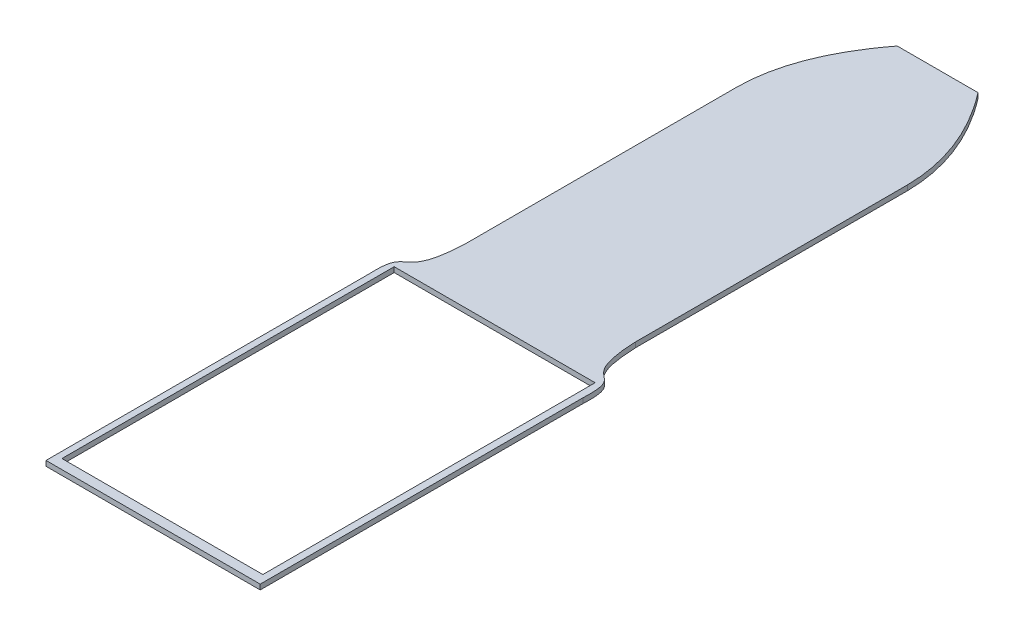
from build123d import *

# Parameters (mm, degrees)
BOSS_EXTRUDE1_DEPTH = 1.5
SKETCH17_W          = 59.095547363
SKETCH17_H          = 97.719033267
CUT_EXTRUDE2_DEPTH  = 165.658179571


with BuildPart() as part:
    # Sketch1 → Boss-Extrude1 (new body)
    with BuildSketch(Plane(origin=(0, 0, 0), x_dir=(-1, 0, 0), z_dir=(0, -1, 0))):
        with BuildLine():
            Line((-68.228994051, -80.900990016), (-68.228994051, 14.099009984))
            add(Edge.make_bspline(
                [(-61.728994051, 35.999084059), (-62.421478219, 17.933639863), (-67.544211434, 25.081077147), (-68.540266051, 21.159243181), (-68.228994051, 14.099009984)],
                knots=[0, 0, 0, 0, 0, 1, 1, 1, 1, 1], degree=4))
            Line((-61.728994051, 35.999084059), (-61.728994051, 115.999084059))
            add(Edge.make_bspline(
                [(-61.728994051, 115.999084059), (-61.589708219, 128.711907965), (-56.064830782, 140.140701438), (-48.600220127, 149.828937742)],
                knots=[0, 0, 0, 0, 1, 1, 1, 1], degree=3))
            Line((-48.600220127, 149.828937742), (-24.857767976, 149.828937742))
            add(Edge.make_bspline(
                [(-11.728994051, 115.999084059), (-11.868279883, 128.711907965), (-17.39315732, 140.140701438), (-24.857767976, 149.828937742)],
                knots=[0, 0, 0, 0, 1, 1, 1, 1], degree=3))
            Line((-11.728994051, 115.999084059), (-11.728994051, 35.999084059))
            add(Edge.make_bspline(
                [(-11.728994051, 35.999084059), (-11.036509883, 17.933639863), (-5.913776668, 25.081077147), (-4.917722051, 21.159243181), (-5.228994051, 14.099009984)],
                knots=[0, 0, 0, 0, 0, 1, 1, 1, 1, 1], degree=4))
            Line((-5.228994051, 14.099009984), (-5.228994051, -80.900990016))
            Line((-5.228994051, -80.900990016), (-68.228994051, -80.900990016))
        make_face()
    extrude(amount=BOSS_EXTRUDE1_DEPTH)

    # Sketch17 → Cut-Extrude2 (cut, through all)
    with BuildSketch(Plane(origin=(0, 0, 0), x_dir=(1, 0, 0), z_dir=(0, 1, 0))):
        with Locations((36.634404956, -29.217068725)):
            Rectangle(SKETCH17_W, SKETCH17_H)
    extrude(amount=-CUT_EXTRUDE2_DEPTH, mode=Mode.SUBTRACT)


solid = part.part
